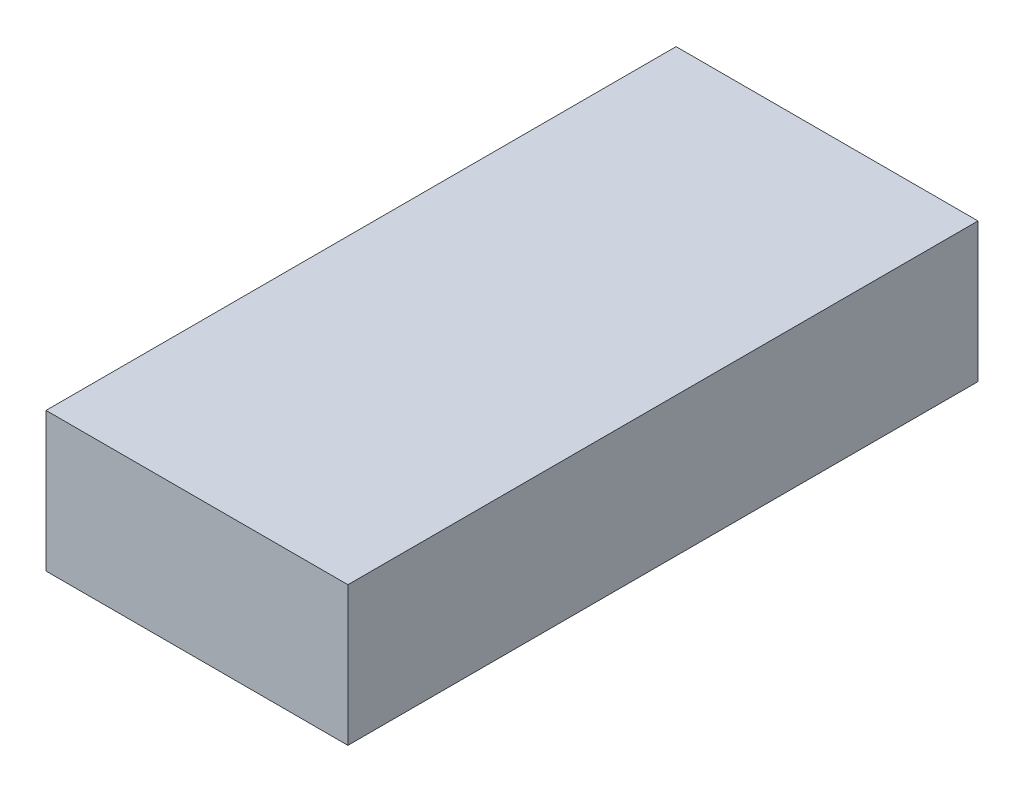
from build123d import *

# Parameters (mm, degrees)
SKETCH_1_W      = 115
SKETCH_1_H      = 240
EXTRUDE_1_DEPTH = 53


with BuildPart() as part:
    # 草图1 → 凸台-拉伸1 (new body)
    with BuildSketch(Plane(origin=(0, 0, 0), x_dir=(1, 0, 0), z_dir=(0, 1, 0))):
        Rectangle(SKETCH_1_W, SKETCH_1_H)
    extrude(amount=EXTRUDE_1_DEPTH)


solid = part.part
